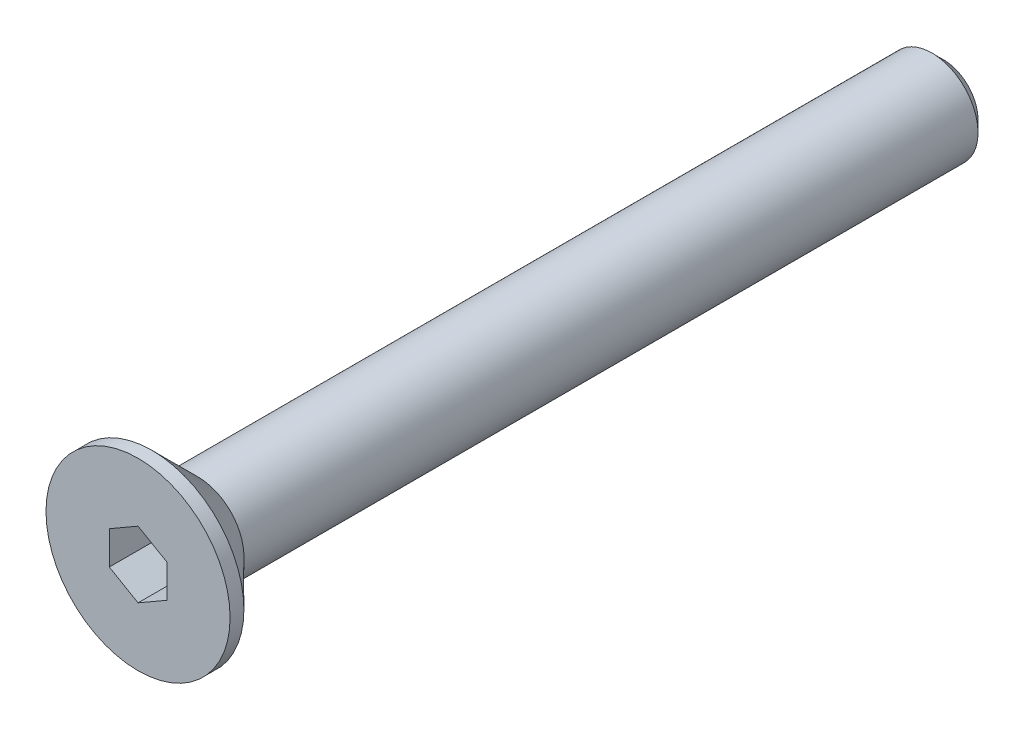
from build123d import *

# Parameters (mm, degrees)
CHAMFER_1_SIZE      = 0.5
CUT_EXTRUDE_1_DEPTH = 2.5


with BuildPart() as part:
    # 草图1 → 旋转1 (revolve)
    with BuildSketch(Plane(origin=(0, 0, 0), x_dir=(0, 0, -1), z_dir=(1, 0, 0)), mode=Mode.PRIVATE) as revolve_1_sk:
        Polygon((-17.5, 0), (-17.5, 4), (-16.9, 4), (-14.9, 2), (17.5, 2), (17.5, 0), align=None)
    revolve(revolve_1_sk.sketch.rotate(Axis((0, 0, -17.5), (0, 0, 1)), 90), axis=Axis((0, 0, -17.5), (0, 0, 1)))

    # 倒角1
    chamfer_1_edges = [part.edges().sort_by_distance(p)[0] for p in [
        (2, 0, -17.5),
    ]]
    chamfer(chamfer_1_edges, length=CHAMFER_1_SIZE)

    # 草图2 → 切除-拉伸1 (cut)
    with BuildSketch(Plane.XY.offset(17.5)):
        Polygon((0, 1.443375673), (-1.25, 0.721687836), (-1.25, -0.721687836), (0, -1.443375673), (1.25, -0.721687836), (1.25, 0.721687836), align=None)
    extrude(amount=-CUT_EXTRUDE_1_DEPTH, mode=Mode.SUBTRACT)


solid = part.part
